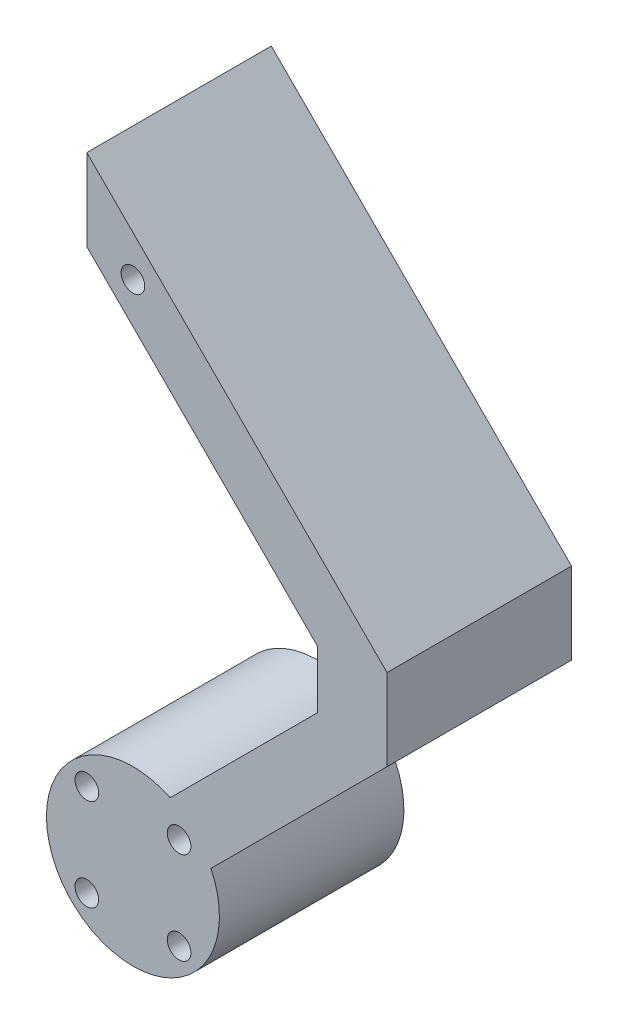
from build123d import *

# Parameters (mm, degrees)
SKETCH1_R           = 2.05
BOSS_EXTRUDE2_DEPTH = 32


with BuildPart() as part:
    # Sketch1 → Boss-Extrude2 (new body)
    with BuildSketch(Plane.XY):
        with BuildLine():
            Line((40, -5), (14.464466094, -30.535533906))
            ThreePointArc((14.464466094, -30.535533906), (-2.606601718, -54.67766953), (21.535533906, -37.606601718))
            Line((21.535533906, -37.606601718), (52.071067812, -7.071067812))
            Line((52.071067812, -7.071067812), (52.071067812, 7.071067812))
            Line((52.071067812, 7.071067812), (0, 59.142135624))
            Line((0, 59.142135624), (0, 45))
            Line((0, 45), (40, 5))
            Line((40, 5), (40, -5))
        make_face()
        with Locations((0, -52.071067812)):
            Circle(SKETCH1_R, mode=Mode.SUBTRACT)
        with Locations((16, -52.071067812)):
            Circle(SKETCH1_R, mode=Mode.SUBTRACT)
        with Locations((16, -36.071067812)):
            Circle(SKETCH1_R, mode=Mode.SUBTRACT)
        with Locations((0, -36.071067812)):
            Circle(SKETCH1_R, mode=Mode.SUBTRACT)
        with Locations((8, 44.071067812)):
            Circle(SKETCH1_R, mode=Mode.SUBTRACT)
    extrude(amount=BOSS_EXTRUDE2_DEPTH)


solid = part.part
